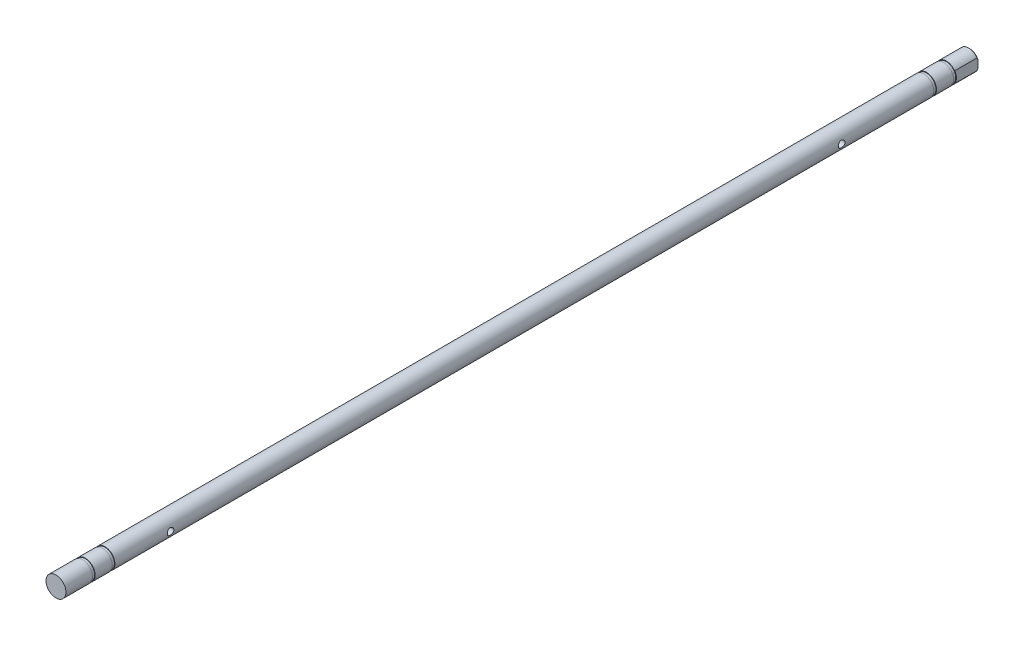
from build123d import *

# Parameters (mm, degrees)
SKETCH1_R                       = 3
BOSS_EXTRUDE1_DEPTH             = 275
SKETCH3_W                       = 0.8
SKETCH3_H                       = 0.5
CUT_EXTRUDE2_DEPTH              = 276.032725326
CUT_EXTRUDE2_DEPTH_BACK         = 276.032725326
SKETCH4_W                       = 3.470061058
SKETCH4_H                       = 7
SKETCH4_W_2                     = 2.92528695
CHAMFER1_SIZE                   = 0.3
RETAINING_GROOVES_D5P7_1_START  = 7.05
SKETCH5_R                       = 2.85
SKETCH5_R_2                     = 2.49
RETAINING_GROOVES_D5P7_1_DEPTH  = 0.8
RETAINING_GROOVES_D5P7_2_START  = 13
SKETCH6_R                       = 2.85
SKETCH6_R_2                     = 2.49
RETAINING_GROOVES_D5P7_2_DEPTH  = 0.8
RETAINING_GROOVES_D5P7_3_START  = 260.25
SKETCH7_R                       = 2.85
SKETCH7_R_2                     = 2.49
RETAINING_GROOVES_D5P7_3_DEPTH  = 0.8
RETAINING_GROOVES_D5P7_4_START  = 266.2
SKETCH8_R                       = 2.85
SKETCH8_R_2                     = 2.49
RETAINING_GROOVES_D5P7_4_DEPTH  = 0.8
TWO_HUB_CROSS_PIN_D2_DEPTH      = 276.032725326
TWO_HUB_CROSS_PIN_D2_DEPTH_BACK = 276.032725326
SKETCH9_R                       = 1


with BuildPart() as part:
    # Sketch1 → Boss-Extrude1 (new body)
    with BuildSketch(Plane.XY):
        Circle(SKETCH1_R)
    extrude(amount=BOSS_EXTRUDE1_DEPTH)

    # Sketch3 → Cut-Revolve1 (revolve, cut)
    with BuildSketch(Plane(origin=(0, 0, 0), x_dir=(0, 0, -1), z_dir=(1, 0, 0)), mode=Mode.PRIVATE) as cut_revolve1_sk:
        with Locations((-266.6, 2.75)):
            Rectangle(SKETCH3_W, SKETCH3_H)
        with Locations((-260.65, 2.75)):
            Rectangle(SKETCH3_W, SKETCH3_H)
        with Locations((-13.4, 2.75)):
            Rectangle(SKETCH3_W, SKETCH3_H)
        with Locations((-7.45, 2.75)):
            Rectangle(SKETCH3_W, SKETCH3_H)
    revolve(cut_revolve1_sk.sketch.rotate(Axis((0, 0, 263.365004794), (0, 0, -1)), 90), axis=Axis((0, 0, 263.365004794), (0, 0, -1)), mode=Mode.SUBTRACT)

    # Sketch4 → Cut-Extrude2 (cut, two sides: drawn at the far end of the back side and taken through both)
    with BuildSketch(Plane(origin=(0, 0, 0), x_dir=(1, 0, 0), z_dir=(0, 1, 0)).offset(-CUT_EXTRUDE2_DEPTH_BACK)):
        with Locations((4.235030529, -3.5)):
            Rectangle(SKETCH4_W, SKETCH4_H)
        with Locations((-3.962643475, -3.5)):
            Rectangle(SKETCH4_W_2, SKETCH4_H)
    extrude(amount=CUT_EXTRUDE2_DEPTH + CUT_EXTRUDE2_DEPTH_BACK, mode=Mode.SUBTRACT)

    # Chamfer1
    chamfer1_edges = [part.edges().sort_by_distance(p)[0] for p in [
        (0, 3, 0),
        (0, -3, 0),
    ]]
    chamfer(chamfer1_edges, length=CHAMFER1_SIZE)

    # Sketch5 → Retaining_Grooves_D5p7_1 (add)
    with BuildSketch(Plane.XY.offset(RETAINING_GROOVES_D5P7_1_START)):
        Circle(SKETCH5_R)
        Circle(SKETCH5_R_2, mode=Mode.SUBTRACT)
    extrude(amount=RETAINING_GROOVES_D5P7_1_DEPTH)

    # Sketch6 → Retaining_Grooves_D5p7_2 (add)
    with BuildSketch(Plane.XY.offset(RETAINING_GROOVES_D5P7_2_START)):
        Circle(SKETCH6_R)
        Circle(SKETCH6_R_2, mode=Mode.SUBTRACT)
    extrude(amount=RETAINING_GROOVES_D5P7_2_DEPTH)

    # Sketch7 → Retaining_Grooves_D5p7_3 (add)
    with BuildSketch(Plane.XY.offset(RETAINING_GROOVES_D5P7_3_START)):
        Circle(SKETCH7_R)
        Circle(SKETCH7_R_2, mode=Mode.SUBTRACT)
    extrude(amount=RETAINING_GROOVES_D5P7_3_DEPTH)

    # Sketch8 → Retaining_Grooves_D5p7_4 (add)
    with BuildSketch(Plane.XY.offset(RETAINING_GROOVES_D5P7_4_START)):
        Circle(SKETCH8_R)
        Circle(SKETCH8_R_2, mode=Mode.SUBTRACT)
    extrude(amount=RETAINING_GROOVES_D5P7_4_DEPTH)

    # Sketch9 → Two_Hub_Cross_Pin_D2 (cut, two sides: drawn at the far end of the back side and taken through both)
    with BuildSketch(Plane(origin=(0, 0, 0), x_dir=(0, 0, -1), z_dir=(1, 0, 0)).offset(-TWO_HUB_CROSS_PIN_D2_DEPTH_BACK)):
        with Locations((-41.5, 0)):
            Circle(SKETCH9_R)
        with Locations((-243.5, 0)):
            Circle(SKETCH9_R)
    extrude(amount=TWO_HUB_CROSS_PIN_D2_DEPTH + TWO_HUB_CROSS_PIN_D2_DEPTH_BACK, mode=Mode.SUBTRACT)


solid = part.part
